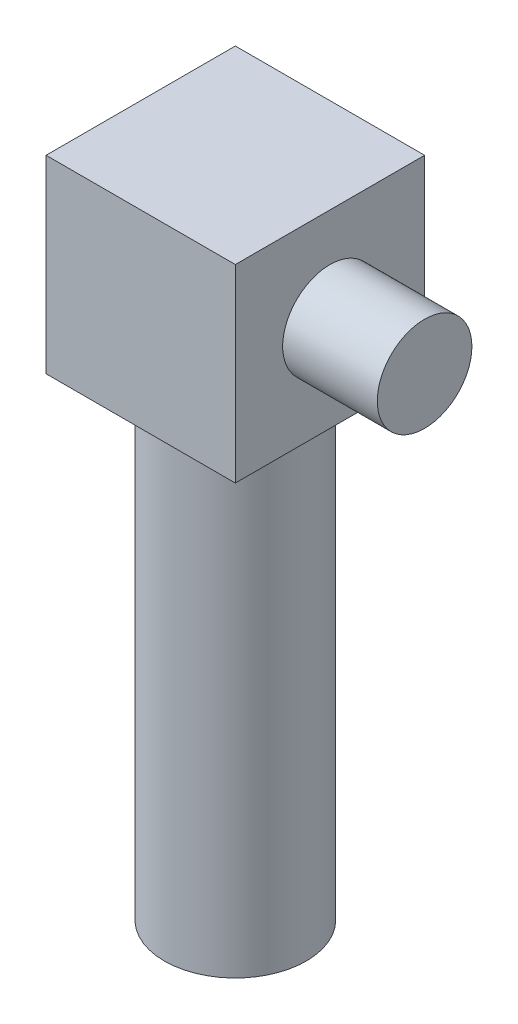
from build123d import *

# Parameters (mm, degrees)
SKETCH1_R           = 7.5
SKETCH1_R_2         = 5
BOSS_EXTRUDE1_DEPTH = 50
SKETCH3_W           = 20
SKETCH3_H           = 20
SKETCH3_R           = 7.5
SKETCH3_R_2         = 5
BOSS_EXTRUDE2_DEPTH = 20
SKETCH4_R           = 5
BOSS_EXTRUDE3_DEPTH = 10


with BuildPart() as part:
    # Sketch1 → Boss-Extrude1 (new body)
    with BuildSketch(Plane(origin=(0, 0, 0), x_dir=(1, 0, 0), z_dir=(0, 1, 0))):
        with Locations(Location((0, 0, 0), (0, 0, 270))):
            Circle(SKETCH1_R)
        with Locations(Location((0, 0, 0), (0, 0, 270))):
            Circle(SKETCH1_R_2, mode=Mode.SUBTRACT)
    extrude(amount=BOSS_EXTRUDE1_DEPTH)

    # Sketch3 → Boss-Extrude2 (add)
    # profile 1 of 3: a face of its own
    with BuildSketch(Plane(origin=(0, 50, 0), x_dir=(1, 0, 0), z_dir=(0, 1, 0))):
        Rectangle(SKETCH3_W, SKETCH3_H)
        with Locations(Location((0, 0, 0), (0, 0, 270))):
            Circle(SKETCH3_R, mode=Mode.SUBTRACT)
    # profile 2 of 3: a face of its own
    with BuildSketch(Plane(origin=(0, 50, 0), x_dir=(1, 0, 0), z_dir=(0, 1, 0))):
        with Locations(Location((0, 0, 0), (0, 0, 270))):
            Circle(SKETCH3_R)
        with Locations(Location((0, 0, 0), (0, 0, 270))):
            Circle(SKETCH3_R_2, mode=Mode.SUBTRACT)
    # profile 3 of 3: a face of its own
    with BuildSketch(Plane(origin=(0, 50, 0), x_dir=(1, 0, 0), z_dir=(0, 1, 0))):
        with Locations(Location((0, 0, 0), (0, 0, 270))):
            Circle(SKETCH3_R_2)
    extrude(amount=BOSS_EXTRUDE2_DEPTH)

    # Sketch4 → Boss-Extrude3 (add)
    with BuildSketch(Plane(origin=(10, 0, 0), x_dir=(0, 0, -1), z_dir=(1, 0, 0))):
        with Locations((0, 60)):
            Circle(SKETCH4_R)
    extrude(amount=BOSS_EXTRUDE3_DEPTH)


solid = part.part
